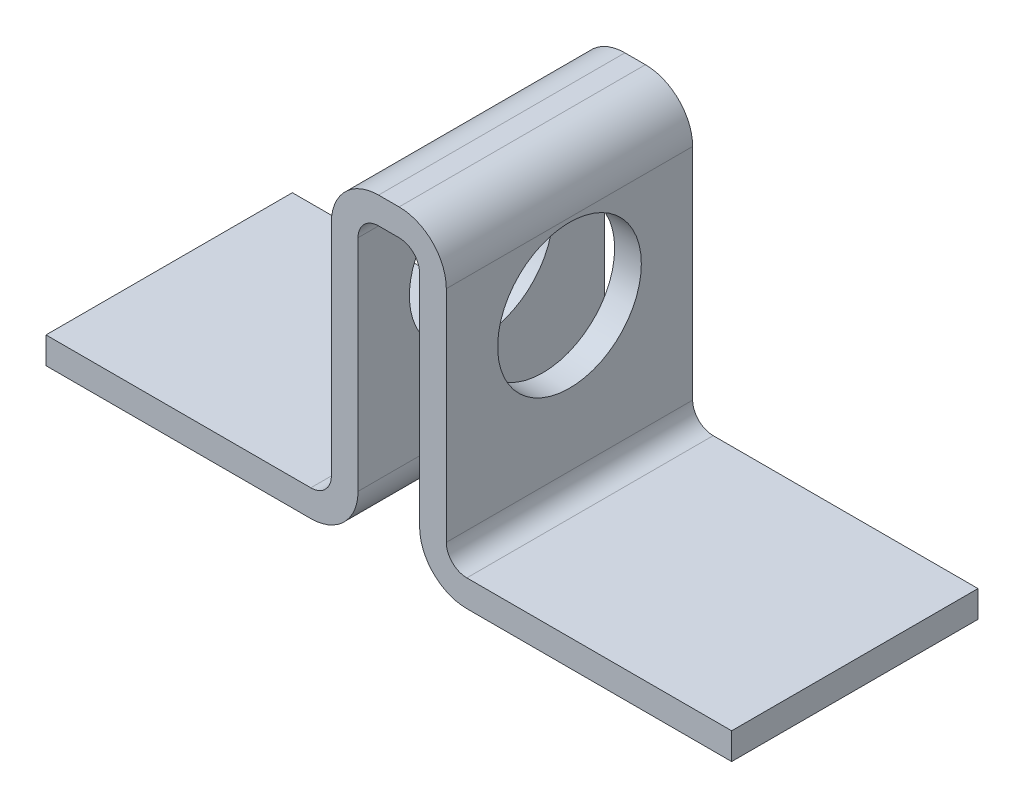
from build123d import *

# Parameters (mm, degrees)
EXTRUDE_1_DEPTH       = 12
HOLE_WIZARD_7_0_7_1_D = 7


with BuildPart() as part:
    # 草图1 → 拉伸-薄壁1 (new body)
    with BuildSketch(Plane.XY):
        with BuildLine():
            Line((-16.7, 0), (-3.8, 0))
            ThreePointArc((-3.8, 0), (-2.173654403, 0.673654403), (-1.5, 2.3))
            Line((-1.5, 2.3), (-1.5, 13))
            ThreePointArc((-1.5, 13), (-1.207106781, 13.707106781), (-0.5, 14))
            Line((-0.5, 14), (0.5, 14))
            ThreePointArc((0.5, 14), (1.207106781, 13.707106781), (1.5, 13))
            Line((1.5, 13), (1.5, 2.3))
            ThreePointArc((1.5, 2.3), (2.173654403, 0.673654403), (3.8, 0))
            Line((3.8, 0), (16.7, 0))
            Line((16.7, 0), (16.7, 1.3))
            Line((16.7, 1.3), (3.8, 1.3))
            ThreePointArc((3.8, 1.3), (3.092893219, 1.592893219), (2.8, 2.3))
            Line((2.8, 2.3), (2.8, 13))
            ThreePointArc((2.8, 13), (2.126345597, 14.626345597), (0.5, 15.3))
            Line((0.5, 15.3), (-0.5, 15.3))
            ThreePointArc((-0.5, 15.3), (-2.126345597, 14.626345597), (-2.8, 13))
            Line((-2.8, 13), (-2.8, 2.3))
            ThreePointArc((-2.8, 2.3), (-3.092893219, 1.592893219), (-3.8, 1.3))
            Line((-3.8, 1.3), (-16.7, 1.3))
            Line((-16.7, 1.3), (-16.7, 0))
        make_face()
    extrude(amount=EXTRUDE_1_DEPTH)

    # Ø7.0 (7) 直径孔1 (through all)
    with Locations(Plane(origin=(2.8, 0, 0), x_dir=(0, 0, -1), z_dir=(1, 0, 0))):
        with Locations((-6, 9.3)):
            Hole(HOLE_WIZARD_7_0_7_1_D / 2)


solid = part.part
